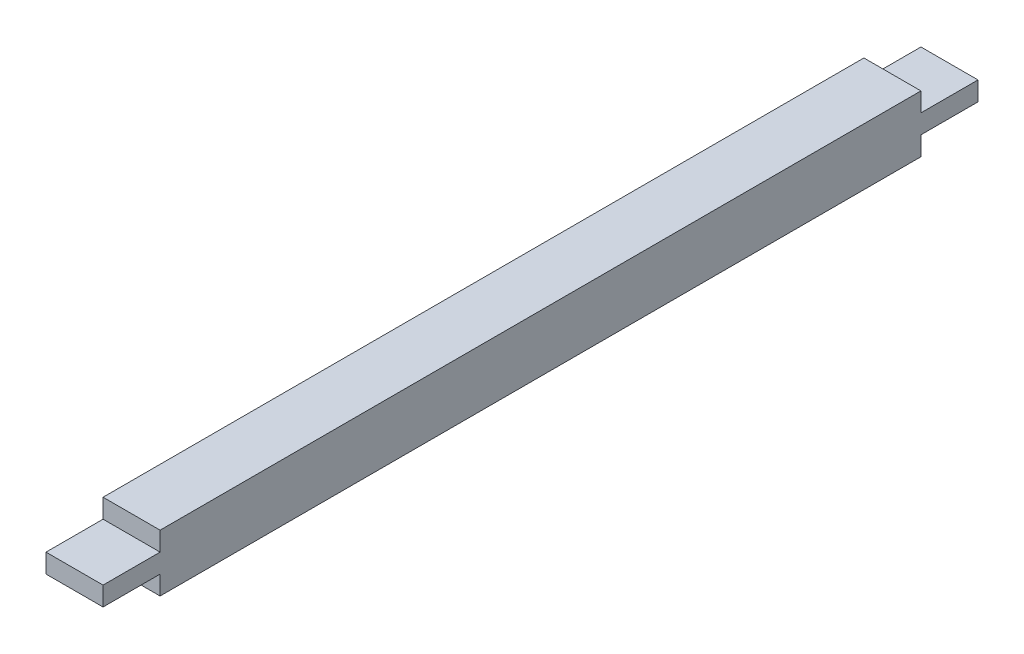
from build123d import *

# Parameters (mm, degrees)
CROQUIS1_W              = 29.994038168
CROQUIS1_H              = 460
SALIENTE_EXTRUIR1_DEPTH = 5
CROQUIS2_W              = 29.994038168
CROQUIS2_H              = 400
SALIENTE_EXTRUIR2_DEPTH = 15


with BuildPart() as part:
    # Croquis1 → Saliente-Extruir1 (new, symmetric)
    with BuildSketch(Plane(origin=(0, 0, 0), x_dir=(1, 0, 0), z_dir=(0, 1, 0))):
        with Locations((-165, 0)):
            Rectangle(CROQUIS1_W, CROQUIS1_H)
    extrude(amount=SALIENTE_EXTRUIR1_DEPTH, both=True)

    # Croquis2 → Saliente-Extruir2 (add, symmetric)
    with BuildSketch(Plane(origin=(0, 0, 0), x_dir=(1, 0, 0), z_dir=(0, 1, 0))):
        with Locations((-165, 0)):
            Rectangle(CROQUIS2_W, CROQUIS2_H)
    extrude(amount=SALIENTE_EXTRUIR2_DEPTH, both=True)


solid = part.part
